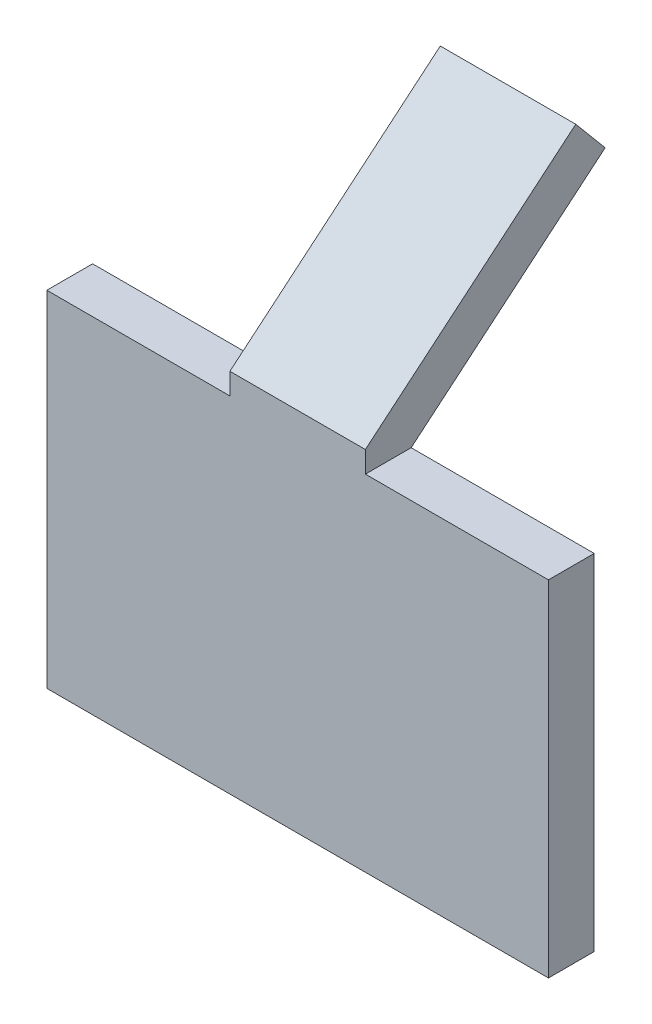
from build123d import *

# Parameters (mm, degrees)
BOSS_EXTRUDE1_DEPTH = 18.796
SKETCH2_W           = 6.35
SKETCH2_H           = 47.838946371
BOSS_EXTRUDE2_DEPTH = 25.4
SKETCH3_W           = 6.35
SKETCH3_H           = 47.838946371
BOSS_EXTRUDE3_DEPTH = 25.4


with BuildPart() as part:
    # Sketch1 → Boss-Extrude1 (new body)
    with BuildSketch(Plane(origin=(0, 0, 0), x_dir=(0, 0, -1), z_dir=(1, 0, 0))):
        Polygon((0, 0), (0, -50.8), (6.35, -50.8), (6.35, -2.961053629), (33.267994604, 19.625825715), (29.186293283, 24.490207929), align=None)
    extrude(amount=BOSS_EXTRUDE1_DEPTH)

    # Sketch2 → Boss-Extrude2 (add)
    with BuildSketch(Plane(origin=(18.796, 0, 0), x_dir=(0, 0, -1), z_dir=(1, 0, 0))):
        with Locations((3.175, -26.880526815)):
            Rectangle(SKETCH2_W, SKETCH2_H)
    extrude(amount=BOSS_EXTRUDE2_DEPTH)

    # Sketch3 → Boss-Extrude3 (add)
    with BuildSketch(Plane.ZY):
        with Locations((-3.175, -26.880526815)):
            Rectangle(SKETCH3_W, SKETCH3_H)
    extrude(amount=BOSS_EXTRUDE3_DEPTH)


solid = part.part
